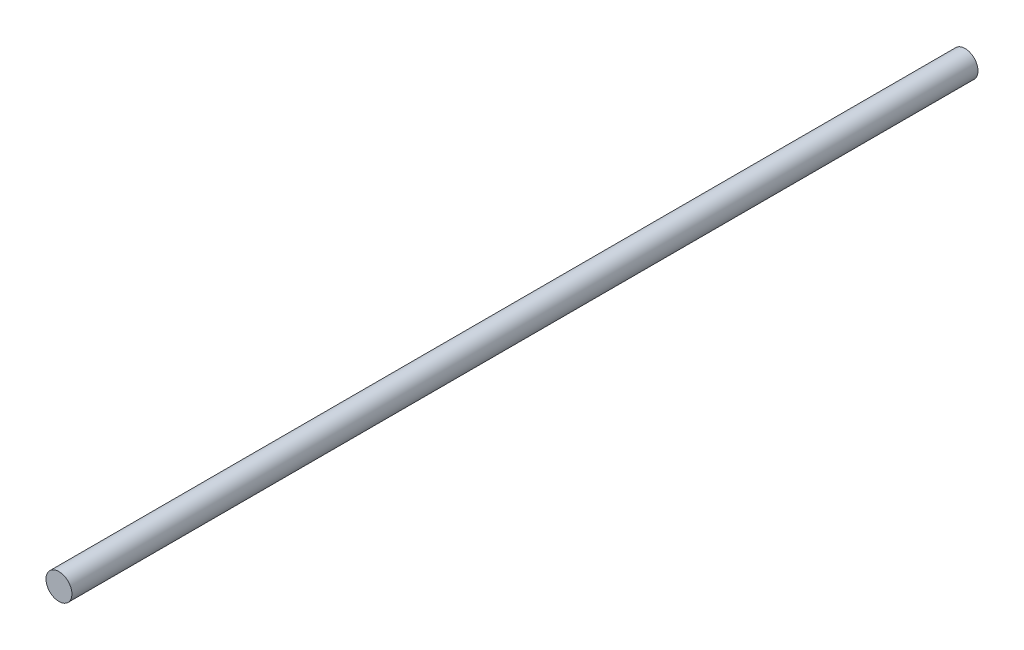
from build123d import *

# Parameters (mm, degrees)
SKETCH1_R           = 0.3200019
BOSS_EXTRUDE1_DEPTH = 22.352


with BuildPart() as part:
    # Sketch1 → Boss-Extrude1 (new body)
    with BuildSketch(Plane.XY):
        Circle(SKETCH1_R)
    extrude(amount=BOSS_EXTRUDE1_DEPTH)


solid = part.part
